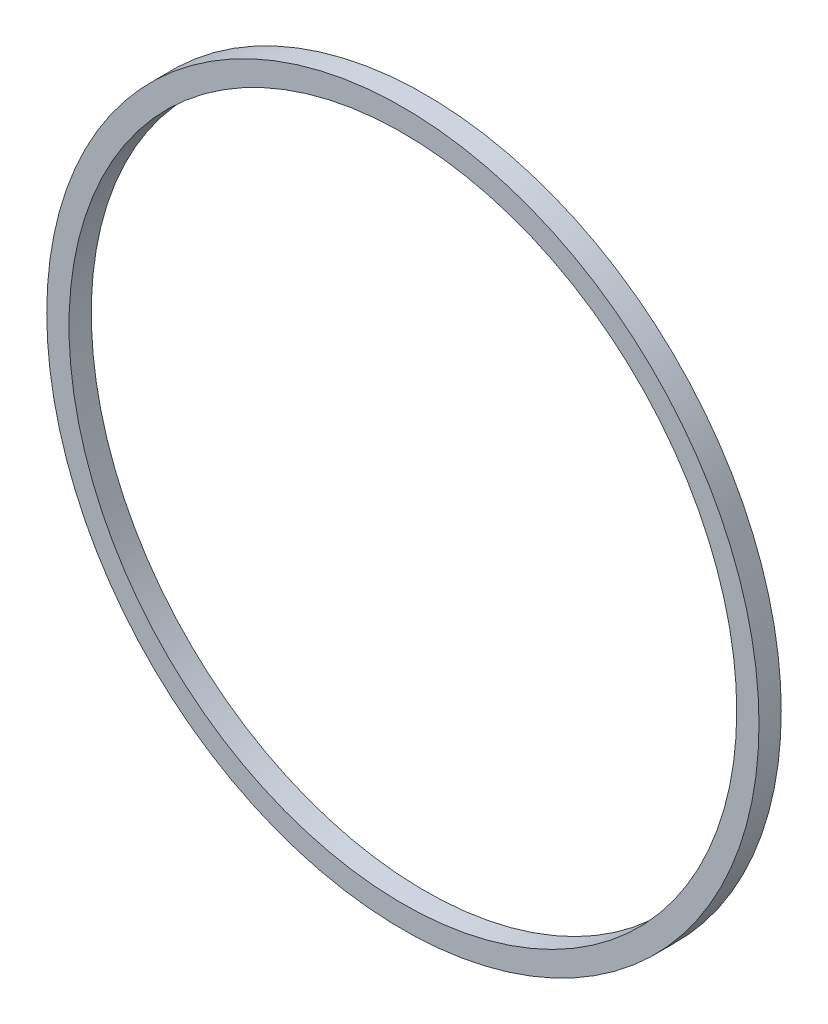
from build123d import *

# Parameters (mm, degrees)
SKETCH_1_R      = 16
SKETCH_1_R_2    = 15
EXTRUDE_1_DEPTH = 1


with BuildPart() as part:
    # 草图1 → 凸台-拉伸1 (new body)
    with BuildSketch(Plane.XY):
        Circle(SKETCH_1_R)
        Circle(SKETCH_1_R_2, mode=Mode.SUBTRACT)
    extrude(amount=EXTRUDE_1_DEPTH)


solid = part.part
